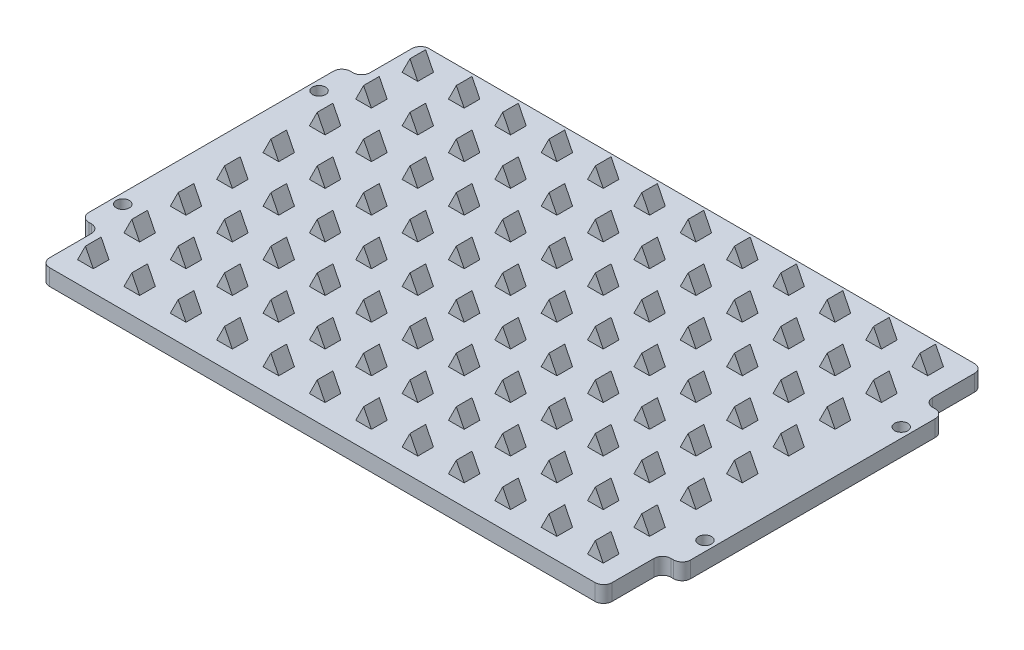
from build123d import *

# Parameters (mm, degrees)
SKETCH1_W            = 109.22
SKETCH1_H            = 73.66
BOSS_EXTRUDE1_DEPTH  = 3.175
BOSS_EXTRUDE3_DEPTH  = 1.524
LPATTERN1_COUNT      = 12
LPATTERN1_PITCH      = 9.000000034
LPATTERN1_COUNT_DIR2 = 8
LPATTERN1_PITCH_DIR2 = 9.000000034
SKETCH3_W            = 3.81
SKETCH3_H            = 50.8
SKETCH3_R            = 1.27
BOSS_EXTRUDE2_DEPTH  = 3.175
FILLET1_R            = 1.651


with BuildPart() as part:
    # Sketch1 → Boss-Extrude1 (new body)
    with BuildSketch(Plane(origin=(0, 0, 0), x_dir=(1, 0, 0), z_dir=(0, 1, 0))):
        Rectangle(SKETCH1_W, SKETCH1_H)
    extrude(amount=-BOSS_EXTRUDE1_DEPTH)

    # Sketch2 → Boss-Extrude3 (add, symmetric)
    with BuildSketch(Plane.XY.offset(-31.75)):
        Polygon((-51.562, 0), (-50.038, 3.048), (-48.514, 0), (-50.038, 0), align=None)
    boss_extrude3 = extrude(amount=BOSS_EXTRUDE3_DEPTH, both=True)

    # LPattern1: Boss-Extrude3 12 × 8
    with Locations(*[(i * LPATTERN1_PITCH, 0, j * LPATTERN1_PITCH_DIR2) for i in range(LPATTERN1_COUNT) for j in range(LPATTERN1_COUNT_DIR2) if (i, j) != (0, 0)]):
        add(boss_extrude3)

    # Sketch3 → Boss-Extrude2 (add)
    # profile 1 of 2: a face of its own
    with BuildSketch(Plane(origin=(0, 0, 0), x_dir=(1, 0, 0), z_dir=(0, 1, 0))):
        with Locations((-56.515, 0)):
            Rectangle(SKETCH3_W, SKETCH3_H)
        with Locations(Location((-56.515, 19.05, 0), (0, 0, 270))):
            Circle(SKETCH3_R, mode=Mode.SUBTRACT)
        with Locations(Location((-56.515, -19.05, 0), (0, 0, 270))):
            Circle(SKETCH3_R, mode=Mode.SUBTRACT)
    # profile 2 of 2: a face of its own
    with BuildSketch(Plane(origin=(0, 0, 0), x_dir=(1, 0, 0), z_dir=(0, 1, 0))):
        with Locations((56.515, 0)):
            Rectangle(SKETCH3_W, SKETCH3_H)
        with Locations(Location((56.515, -19.05, 0), (0, 0, 90))):
            Circle(SKETCH3_R, mode=Mode.SUBTRACT)
        with Locations(Location((56.515, 19.05, 0), (0, 0, 90))):
            Circle(SKETCH3_R, mode=Mode.SUBTRACT)
    extrude(amount=-BOSS_EXTRUDE2_DEPTH)

    # Fillet1
    fillet1_edges = [part.edges().sort_by_distance(p)[0] for p in [
        (54.61, -1.5875, -25.4),
        (58.42, -1.5875, -25.4),
        (58.42, -1.5875, 25.4),
        (54.61, -1.5875, 25.4),
        (54.61, -1.5875, 36.83),
        (-54.61, -1.5875, 36.83),
        (-54.61, -1.5875, -36.83),
        (54.61, -1.5875, -36.83),
        (-54.61, -1.5875, -25.4),
        (-54.61, -1.5875, 25.4),
        (-58.42, -1.5875, 25.4),
        (-58.42, -1.5875, -25.4),
    ]]
    fillet(fillet1_edges, radius=FILLET1_R)


solid = part.part
